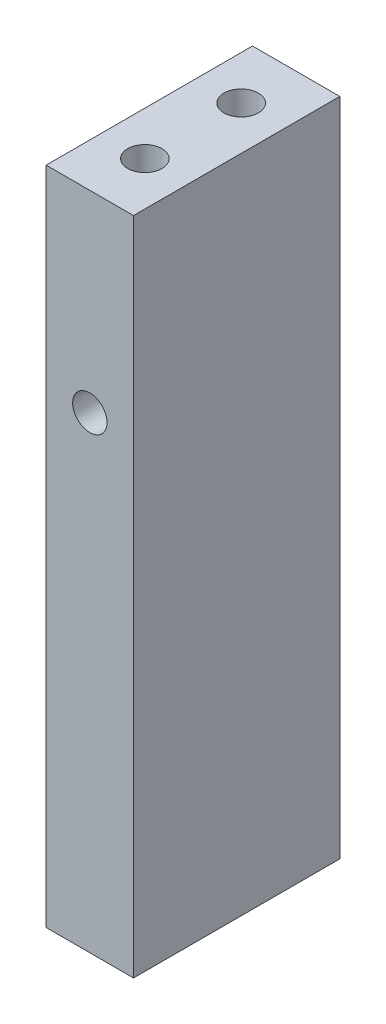
from build123d import *

# Parameters (mm, degrees)
ESBO_O1_W                 = 6.35
ESBO_O1_H                 = 48
RESSALTO_EXTRUS_O1_DEPTH  = 15
FURO_ROSCADO_DE_M31_D     = 2.5
FURO_ROSCADO_DE_M31_DEPTH = 10
FURO_ROSCADO_DE_M31_TIP   = 0.751075774
FURO_ROSCADO_DE_M32_D     = 2.5
FURO_ROSCADO_DE_M32_DEPTH = 10
FURO_ROSCADO_DE_M32_TIP   = 0.751075774
FURO_ROSCADO_DE_M33_D     = 2.5
FURO_ROSCADO_DE_M33_DEPTH = 10
FURO_ROSCADO_DE_M33_TIP   = 0.751075774


with BuildPart() as part:
    # Esboço1 → Ressalto-extrusão1 (new body)
    with BuildSketch(Plane.XY):
        with Locations((3.175, 24)):
            Rectangle(ESBO_O1_W, ESBO_O1_H)
    extrude(amount=RESSALTO_EXTRUS_O1_DEPTH)

    # Furo roscado de M31
    with Locations(Plane(origin=(3.175, 0, 11), x_dir=(0, 0, -1), z_dir=(0, -1, 0))):
        with Locations((0, 0), (7, 0)):
            Hole(FURO_ROSCADO_DE_M31_D / 2, depth=FURO_ROSCADO_DE_M31_DEPTH)
            with Locations((0, 0, -(FURO_ROSCADO_DE_M31_DEPTH + FURO_ROSCADO_DE_M31_TIP / 2))):  # 118° drill point
                Cone(0, FURO_ROSCADO_DE_M31_D / 2, FURO_ROSCADO_DE_M31_TIP, mode=Mode.SUBTRACT)

    # Furo roscado de M32
    with Locations(Plane(origin=(3.175, 48, 4), x_dir=(0, 0, 1), z_dir=(0, 1, 0))):
        with Locations((0, 0), (7, 0)):
            Hole(FURO_ROSCADO_DE_M32_D / 2, depth=FURO_ROSCADO_DE_M32_DEPTH)
            with Locations((0, 0, -(FURO_ROSCADO_DE_M32_DEPTH + FURO_ROSCADO_DE_M32_TIP / 2))):  # 118° drill point
                Cone(0, FURO_ROSCADO_DE_M32_D / 2, FURO_ROSCADO_DE_M32_TIP, mode=Mode.SUBTRACT)

    # Furo roscado de M33
    with Locations(Plane(origin=(3.175, 34, 15), x_dir=(1, 0, 0), z_dir=(0, 0, 1))):
        with Locations((0, 0)):
            Hole(FURO_ROSCADO_DE_M33_D / 2, depth=FURO_ROSCADO_DE_M33_DEPTH)
            with Locations((0, 0, -(FURO_ROSCADO_DE_M33_DEPTH + FURO_ROSCADO_DE_M33_TIP / 2))):  # 118° drill point
                Cone(0, FURO_ROSCADO_DE_M33_D / 2, FURO_ROSCADO_DE_M33_TIP, mode=Mode.SUBTRACT)


solid = part.part
